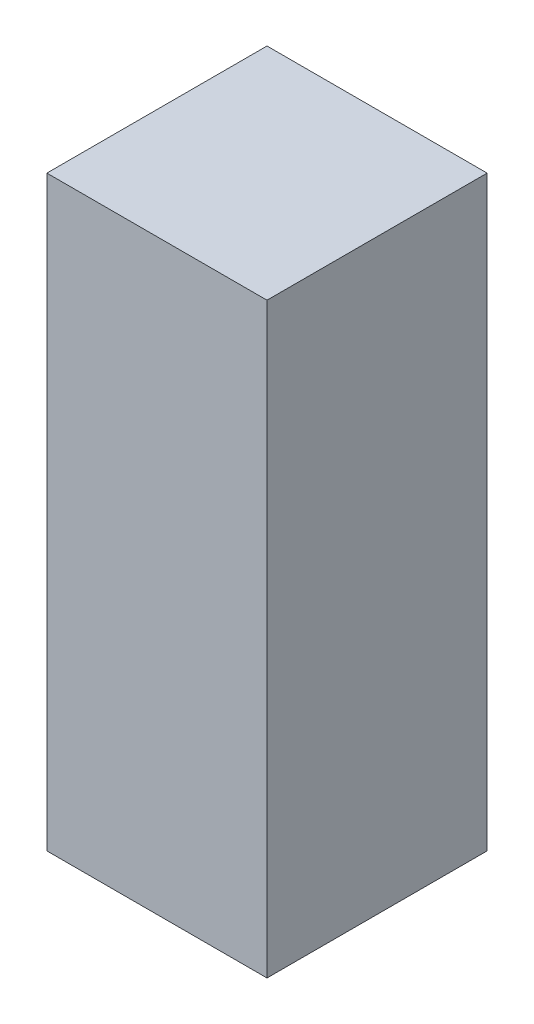
from build123d import *

# Parameters (mm, degrees)
SKETCH1_W           = 1.5
SKETCH1_H           = 1.5
BOSS_EXTRUDE1_DEPTH = 4


with BuildPart() as part:
    # Sketch1 → Boss-Extrude1 (new body)
    with BuildSketch(Plane(origin=(0, 0, 0), x_dir=(1, 0, 0), z_dir=(0, 1, 0))):
        with Locations((0.75, 0.75)):
            Rectangle(SKETCH1_W, SKETCH1_H)
    extrude(amount=BOSS_EXTRUDE1_DEPTH)


solid = part.part
